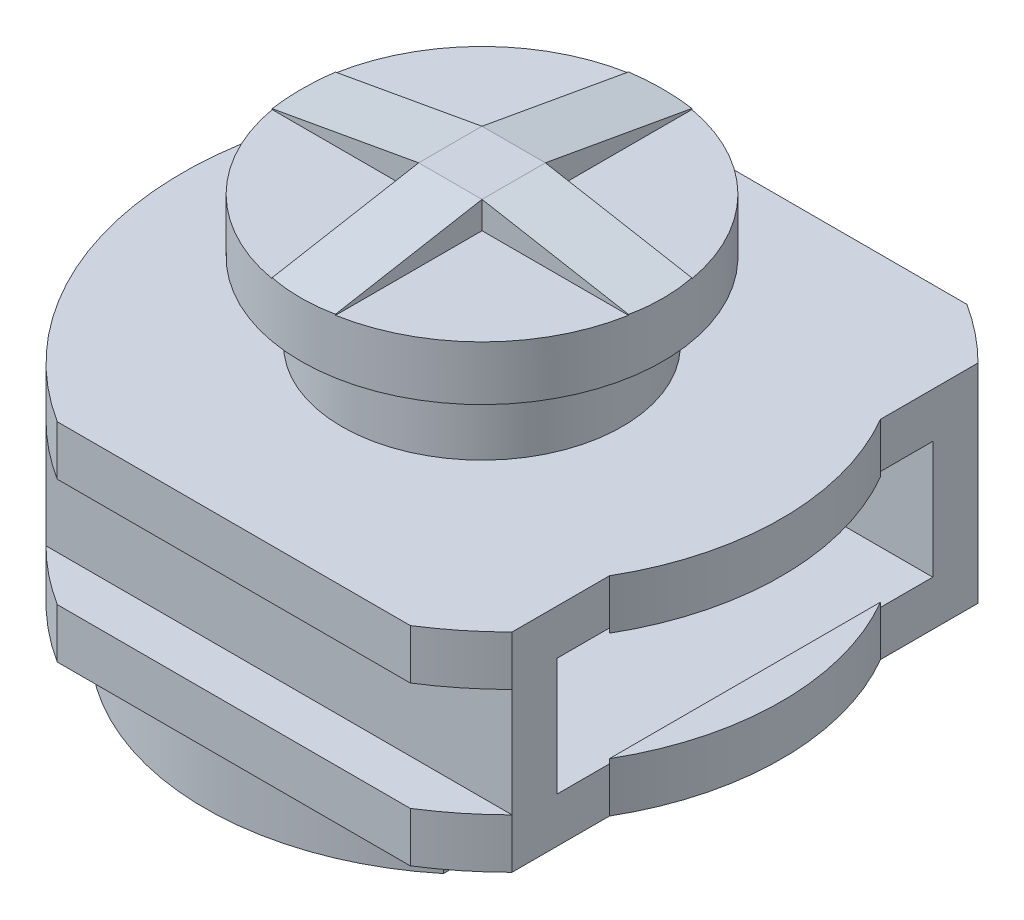
from build123d import *
from build123d.topology import SkipClean

# Parameters (mm, degrees)
SKETCH5_W           = 10.3
SKETCH5_H           = 10.3
BOSS_EXTRUDE2_DEPTH = 4.6
SKETCH6_W           = 8.3
SKETCH6_H           = 2.6
CUT_EXTRUDE3_DEPTH  = 9.3
BOSS_EXTRUDE4_DEPTH = 1.1
BOSS_EXTRUDE5_REACH = 12.83
SKETCH10_R          = 2
CUT_EXTRUDE4_DEPTH  = 12.234169035
SKETCH11_R          = 3.1
SKETCH11_R_2        = 2
BOSS_EXTRUDE6_DEPTH = 1.7
SKETCH12_R          = 4
BOSS_EXTRUDE7_DEPTH = 1.2
BOSS_EXTRUDE8_DEPTH = 0.6
CUT_EXTRUDE7_DEPTH  = 14.165903481
CUT_EXTRUDE8_DEPTH  = 13.784307824
SKETCH16_R          = 6.11839758
SKETCH16_R_2        = 4.91839758
BOSS_EXTRUDE9_DEPTH = 1.2
CUT_EXTRUDE9_START  = -1.2
CUT_EXTRUDE9_DEPTH  = 1.2


with BuildPart() as part:
    # Sketch5 → Boss-Extrude2 (new body)
    with BuildSketch(Plane(origin=(0, 0, 0), x_dir=(1, 0, 0), z_dir=(0, 1, 0))):
        with Locations((0.148353909, 1.208024691)):
            Rectangle(SKETCH5_W, SKETCH5_H)
    extrude(amount=BOSS_EXTRUDE2_DEPTH)

    # Sketch6 → Cut-Extrude3 (cut)
    with BuildSketch(Plane(origin=(5.298353909, 0, 0), x_dir=(0, 0, -1), z_dir=(1, 0, 0))):
        with Locations((1.208024691, 2.3)):
            Rectangle(SKETCH6_W, SKETCH6_H)
    cut_extrude3 = extrude(amount=-CUT_EXTRUDE3_DEPTH, mode=Mode.SUBTRACT)

    # Sketch7 → Boss-Extrude4 (add)
    with BuildSketch(Plane(origin=(0, 4.6, 0), x_dir=(1, 0, 0), z_dir=(0, 1, 0))):
        with BuildLine():
            Line((4.049956144, 7.358024691), (-3.753248326, 7.358024691))
            ThreePointArc((-3.753248326, 7.358024691), (-4.404982862, 6.89240014), (-5.001646091, 6.358024691))
            Line((-5.001646091, 6.358024691), (5.298353909, 6.358024691))
            ThreePointArc((5.298353909, 6.358024691), (4.701690681, 6.89240014), (4.049956144, 7.358024691))
        make_face()
        with BuildLine():
            Line((-5.001646091, -3.941975309), (-5.001646091, 6.358024691))
            ThreePointArc((-5.001646091, 6.358024691), (-7.134845937, 1.208024691), (-5.001646091, -3.941975309))
        make_face()
        with BuildLine():
            Line((5.298353909, -3.941975309), (-5.001646091, -3.941975309))
            ThreePointArc((-5.001646091, -3.941975309), (-4.404982862, -4.476350758), (-3.753248326, -4.941975309))
            Line((-3.753248326, -4.941975309), (4.049956144, -4.941975309))
            ThreePointArc((4.049956144, -4.941975309), (4.701690681, -4.476350758), (5.298353909, -3.941975309))
        make_face()
        with BuildLine():
            ThreePointArc((5.298353909, -1.787660692), (6.106258819, 1.208024691), (5.298353909, 4.203710075))
            Line((5.298353909, 4.203710075), (5.298353909, -1.787660692))
        make_face()
    boss_extrude4 = extrude(amount=-BOSS_EXTRUDE4_DEPTH)

    # Mirror1: Cut-Extrude3, Boss-Extrude4 across plane
    add(cut_extrude3.mirror(Plane.ZX.offset(2.3)), mode=Mode.SUBTRACT)
    add(boss_extrude4.mirror(Plane.ZX.offset(2.3)))

    # Sketch8 → Boss-Extrude5 (add, up to next)
    with BuildSketch(Plane(origin=(0, 1.1, 0), x_dir=(1, 0, 0), z_dir=(0, 1, 0)), mode=Mode.PRIVATE) as boss_extrude5_sk1:
        with BuildLine():
            Line((-6.334845937, 4.52662677), (-6.334845937, -2.110577387))
            ThreePointArc((-6.334845937, -2.110577387), (-5.739883454, -3.078426142), (-5.001646091, -3.941975309))
            Line((-5.001646091, -3.941975309), (-5.001646091, 6.358024691))
            ThreePointArc((-5.001646091, 6.358024691), (-5.739883454, 5.494475525), (-6.334845937, 4.52662677))
        make_face()
    boss_extrude5_tool1 = extrude(boss_extrude5_sk1.sketch, amount=BOSS_EXTRUDE5_REACH, mode=Mode.PRIVATE) - part.part
    add(boss_extrude5_tool1.solids().sort_by_distance((-5.621972, 1.1, -1.208025))[0])

    # Sketch10 → Cut-Extrude4 (cut, through all)
    with SkipClean():  # the faces are left unmerged after this step: merging them gives an invalid solid
        with BuildSketch(Plane.XZ):
            with Locations(Location((-0.514293559, -1.208024691, 0), (0, 0, 270))):
                Circle(SKETCH10_R)
        extrude(amount=-CUT_EXTRUDE4_DEPTH, mode=Mode.SUBTRACT)

    # Sketch11 → Boss-Extrude6 (add)
    with SkipClean():  # the faces are left unmerged after this step: merging them gives an invalid solid
        with BuildSketch(Plane(origin=(0, 4.6, 0), x_dir=(1, 0, 0), z_dir=(0, 1, 0))):
            with Locations(Location((-0.514293559, 1.208024691, 0), (0, 0, 90))):
                Circle(SKETCH11_R)
            with Locations(Location((-0.514293559, 1.208024691, 0), (0, 0, 90))):
                Circle(SKETCH11_R_2, mode=Mode.SUBTRACT)
        extrude(amount=BOSS_EXTRUDE6_DEPTH)

    # Sketch12 → Boss-Extrude7 (add)
    with SkipClean():  # the faces are left unmerged after this step: merging them gives an invalid solid
        with BuildSketch(Plane(origin=(0, 6.3, 0), x_dir=(1, 0, 0), z_dir=(0, 1, 0))):
            with Locations(Location((-0.514293559, 1.208024691, 0), (0, 0, 270))):
                Circle(SKETCH12_R)
        extrude(amount=BOSS_EXTRUDE7_DEPTH)

    # Sketch13 → Boss-Extrude8 (add)
    with SkipClean():  # the faces are left unmerged after this step: merging them gives an invalid solid
        with BuildSketch(Plane(origin=(0, 7.5, 0), x_dir=(1, 0, 0), z_dir=(0, 1, 0))):
            with BuildLine():
                Line((-1.214293559, 5.146298425), (-1.214293559, 1.908024691))
                Line((-1.214293559, 1.908024691), (-4.452567292, 1.908024691))
                ThreePointArc((-4.452567292, 1.908024691), (-4.514293559, 1.208024691), (-4.452567292, 0.508024691))
                Line((-4.452567292, 0.508024691), (-1.214293559, 0.508024691))
                Line((-1.214293559, 0.508024691), (-1.214293559, -2.730249042))
                ThreePointArc((-1.214293559, -2.730249042), (-0.514293559, -2.791975309), (0.185706441, -2.730249042))
                Line((0.185706441, -2.730249042), (0.185706441, 0.508024691))
                Line((0.185706441, 0.508024691), (3.423980175, 0.508024691))
                ThreePointArc((3.423980175, 0.508024691), (3.485706441, 1.208024691), (3.423980175, 1.908024691))
                Line((3.423980175, 1.908024691), (0.185706441, 1.908024691))
                Line((0.185706441, 1.908024691), (0.185706441, 5.146298425))
                ThreePointArc((0.185706441, 5.146298425), (-0.514293559, 5.208024691), (-1.214293559, 5.146298425))
            make_face()
        extrude(amount=BOSS_EXTRUDE8_DEPTH)

    # Sketch14 → Cut-Extrude7 (cut, through all)
    with SkipClean():  # the faces are left unmerged after this step: merging them gives an invalid solid
        with BuildSketch(Plane(origin=(0.185706441, 0, 0), x_dir=(0, 0, -1), z_dir=(1, 0, 0))):
            Polygon((-2.8486475, 7.5), (0.508024691, 8.1), (-2.8486475, 8.1), align=None)
            Polygon((5.264696882, 7.5), (1.908024691, 8.1), (5.264696882, 8.1), align=None)
        extrude(amount=-CUT_EXTRUDE7_DEPTH, mode=Mode.SUBTRACT)

    # Sketch15 → Cut-Extrude8 (cut, through all)
    with SkipClean():  # the faces are left unmerged after this step: merging them gives an invalid solid
        with BuildSketch(Plane.XY.offset(-0.508024691)):
            Polygon((3.521468612, 8.1), (3.521468612, 7.5), (0.185706441, 8.1), align=None)
            Polygon((-4.550055729, 7.5), (-1.214293559, 8.1), (-4.550055729, 8.1), align=None)
        extrude(amount=-CUT_EXTRUDE8_DEPTH, mode=Mode.SUBTRACT)

    # Sketch16 → Boss-Extrude9 (add)
    with SkipClean():  # the faces are left unmerged after this step: merging them gives an invalid solid
        with BuildSketch(Plane.XZ):
            with Locations(Location((-0.514293559, -1.208024691, 0), (0, 0, 270))):
                Circle(SKETCH16_R)
            with Locations(Location((-0.514293559, -1.208024691, 0), (0, 0, 270))):
                Circle(SKETCH16_R_2, mode=Mode.SUBTRACT)
        extrude(amount=BOSS_EXTRUDE9_DEPTH)

    # Sketch17 → Cut-Extrude9 (cut)
    with SkipClean():  # the faces are left unmerged after this step: merging them gives an invalid solid
        with BuildSketch(Plane.XZ.offset(1.2).offset(CUT_EXTRUDE9_START)):
            with BuildLine():
                Line((3.364577542, 1.816044378), (3.364577542, -4.232093761))
                Line((3.364577542, -4.232093761), (3.415683395, -5.897381799))
                ThreePointArc((3.415683395, -5.897381799), (5.604014001, -1.174835129), (3.364577542, 3.523692537))
                Line((3.364577542, 3.523692537), (3.364577542, 1.816044378))
            make_face()
        extrude(amount=CUT_EXTRUDE9_DEPTH, mode=Mode.SUBTRACT)


solid = part.part
